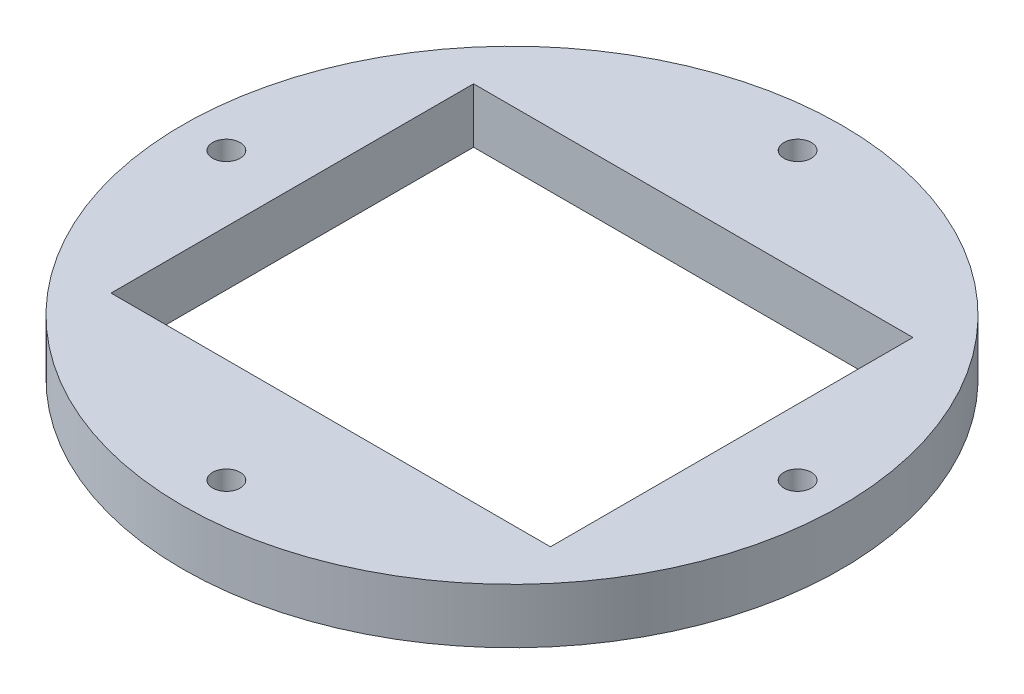
from build123d import *

# Parameters (mm, degrees)
SKETCH1_R           = 38.1
SKETCH1_R_2         = 1.5875
SKETCH1_W           = 50.8
SKETCH1_H           = 41.91
BOSS_EXTRUDE1_DEPTH = 6.35


with BuildPart() as part:
    # Sketch1 → Boss-Extrude1 (new body)
    with BuildSketch(Plane(origin=(0, 0, 0), x_dir=(1, 0, 0), z_dir=(0, 1, 0))):
        with Locations(Location((0, 0, 0), (0, 0, 270))):
            Circle(SKETCH1_R)
        with Locations(Location((0, 33.02, 0), (0, 0, 270))):
            Circle(SKETCH1_R_2, mode=Mode.SUBTRACT)
        with Locations(Location((33.02, 0, 0), (0, 0, 270))):
            Circle(SKETCH1_R_2, mode=Mode.SUBTRACT)
        with Locations(Location((0, -33.02, 0), (0, 0, 270))):
            Circle(SKETCH1_R_2, mode=Mode.SUBTRACT)
        with Locations(Location((-33.02, 0, 0), (0, 0, 270))):
            Circle(SKETCH1_R_2, mode=Mode.SUBTRACT)
        Rectangle(SKETCH1_W, SKETCH1_H, mode=Mode.SUBTRACT)
    extrude(amount=BOSS_EXTRUDE1_DEPTH)


solid = part.part
